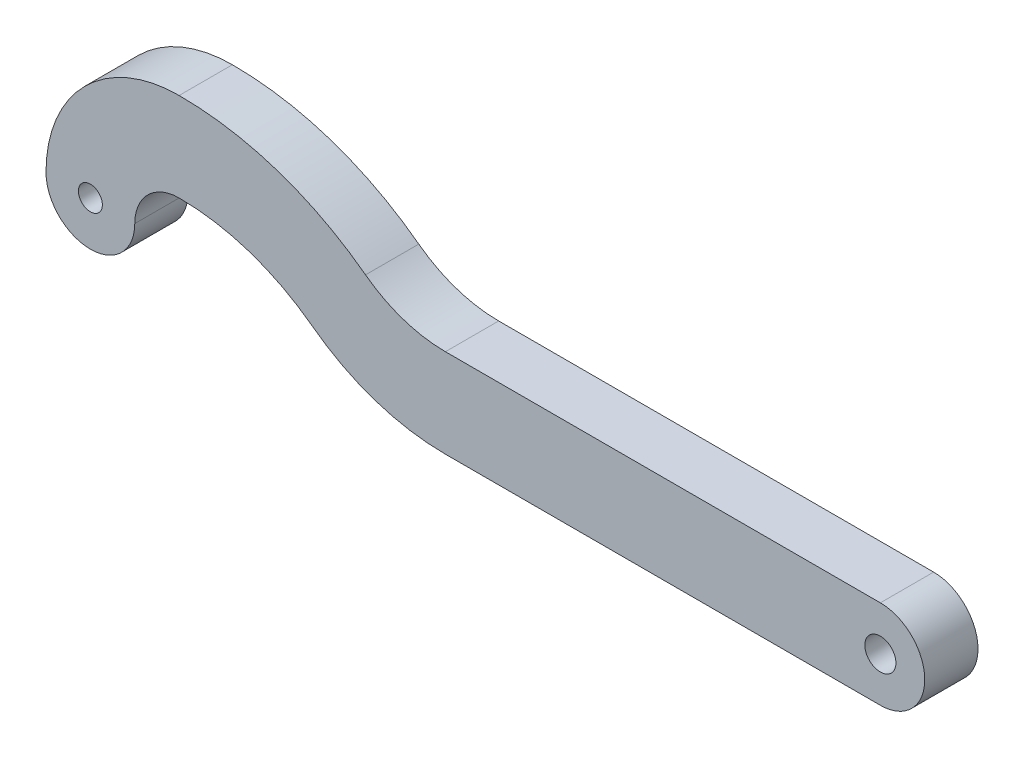
from build123d import *

# Parameters (mm, degrees)
ESQUISSE1_R        = 1.35
ESQUISSE1_R_2      = 1.75
BOSS_EXTRU_1_DEPTH = 6
CHANFREIN1_SIZE    = 1.25


with BuildPart() as part:
    # Esquisse1 → Boss.-Extru.1 (new body)
    with BuildSketch(Plane.XY):
        with BuildLine():
            Line((40, 10), (89, 10))
            ThreePointArc((89, 10), (94, 5), (89, 0))
            Line((89, 0), (40, 0))
            ThreePointArc((40, 0), (32.09430585, 1.282917549), (25, 5))
            ThreePointArc((25, 5), (17.90569415, 8.717082451), (10, 10))
            ThreePointArc((10, 10), (6.464466094, 8.535533906), (5, 5))
            ThreePointArc((5, 5), (3.535533906, 1.464466094), (0, 0))
            ThreePointArc((0, 0), (-3.535533906, 1.464466094), (-5, 5))
            ThreePointArc((-5, 5), (-0.606601718, 15.606601718), (10, 20))
            ThreePointArc((10, 20), (21.067971811, 18.203915432), (31, 13))
            ThreePointArc((31, 13), (35.25658351, 10.769750529), (40, 10))
        make_face()
        with Locations((0, 5)):
            Circle(ESQUISSE1_R, mode=Mode.SUBTRACT)
        with Locations((89, 5)):
            Circle(ESQUISSE1_R_2, mode=Mode.SUBTRACT)
    extrude(amount=BOSS_EXTRU_1_DEPTH)

    # Chanfrein1
    chanfrein1_edges = [part.edges().sort_by_distance(p)[0] for p in [
        (87.25, 5, 0),
    ]]
    chamfer(chanfrein1_edges, length=CHANFREIN1_SIZE)


solid = part.part
